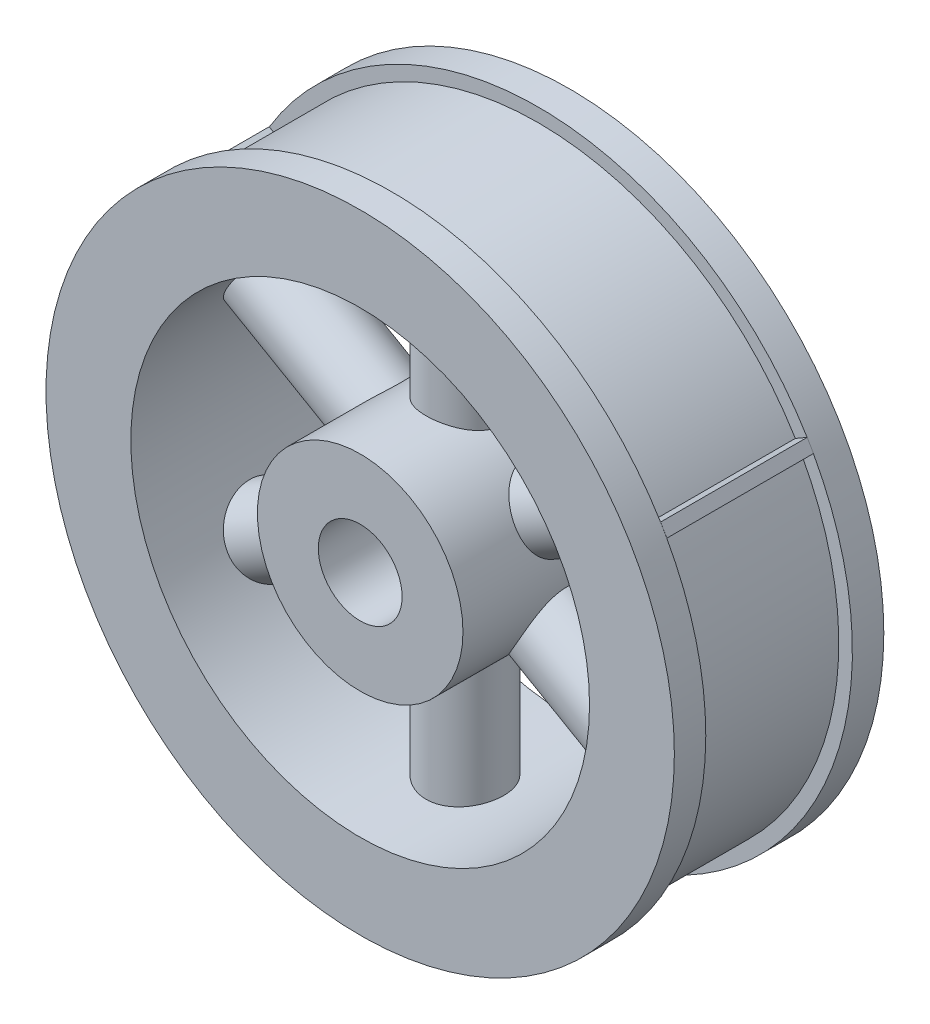
from build123d import *

# Parameters (mm, degrees)
SKETCH2_R           = 4.90735859
SKETCH2_R_2         = 2
BOSS_EXTRUDE1_DEPTH = 10
SKETCH3_R           = 14.35
SKETCH3_R_2         = 10.950119173
BOSS_EXTRUDE2_DEPTH = 10
SKETCH4_R           = 15
SKETCH4_R_2         = 14.35
BOSS_EXTRUDE3_DEPTH = 1.5
SKETCH5_R           = 15
SKETCH5_R_2         = 14.35
BOSS_EXTRUDE4_DEPTH = 1.5
BOSS_EXTRUDE5_DEPTH = 12.5
CIRPATTERN1_COUNT   = 6
SKETCH8_W           = 0.598057902
SKETCH8_H           = 0.656231918
BOSS_EXTRUDE6_DEPTH = 7
CIRPATTERN2_COUNT   = 3
SKETCH10_R          = 2
CUT_EXTRUDE1_DEPTH  = 10


with BuildPart() as part:
    # Sketch2 → Boss-Extrude1 (new body)
    with BuildSketch(Plane.XY):
        Circle(SKETCH2_R)
        Circle(SKETCH2_R_2, mode=Mode.SUBTRACT)
    extrude(amount=BOSS_EXTRUDE1_DEPTH)



with BuildPart() as body_2:
    # Sketch3 → Boss-Extrude2 (new body)
    with BuildSketch(Plane.XY):
        Circle(SKETCH3_R)
        Circle(SKETCH3_R_2, mode=Mode.SUBTRACT)
    extrude(amount=BOSS_EXTRUDE2_DEPTH)

    # Sketch4 → Boss-Extrude3 (add)
    with BuildSketch(Plane.XY):
        Circle(SKETCH4_R)
        Circle(SKETCH4_R_2, mode=Mode.SUBTRACT)
    extrude(amount=BOSS_EXTRUDE3_DEPTH)

    # Sketch5 → Boss-Extrude4 (add)
    with BuildSketch(Plane.XY.offset(10)):
        Circle(SKETCH5_R)
        Circle(SKETCH5_R_2, mode=Mode.SUBTRACT)
    extrude(amount=-BOSS_EXTRUDE4_DEPTH)


with BuildPart() as part_1:
    add(part.part)

    add(body_2.part)  # Boss-Extrude5 merges body 2
    # Sketch7 → Boss-Extrude5 (add)
    with BuildSketch(Plane(origin=(0, 0, 0), x_dir=(-1, 0, 0), z_dir=(0, 1, 0))):
        with BuildLine():
            ThreePointArc((0, 6.854596747), (-1.854596747, 5), (0, 3.145403253))
            Line((0, 3.145403253), (0, 6.854596747))
        make_face()
        with BuildLine():
            Line((0, 6.854596747), (0, 3.145403253))
            ThreePointArc((0, 3.145403253), (1.311397936, 3.688602064), (1.854596747, 5))
            ThreePointArc((1.854596747, 5), (1.311397936, 6.311397936), (0, 6.854596747))
        make_face()
    boss_extrude5 = extrude(amount=-BOSS_EXTRUDE5_DEPTH)

    # CirPattern1: Boss-Extrude5 ×6 about axis
    cirpattern1_axis = Axis((0, 0, 10), (0, 0, 1))
    for i in range(1, CIRPATTERN1_COUNT):
        add(boss_extrude5.rotate(cirpattern1_axis, i * 360 / CIRPATTERN1_COUNT))

    # Sketch8 → Boss-Extrude6 (add)
    with BuildSketch(Plane.XY.offset(1.5)):
        with Locations((0, -14.675)):
            Rectangle(SKETCH8_W, SKETCH8_H)
    boss_extrude6 = extrude(amount=BOSS_EXTRUDE6_DEPTH)

    # CirPattern2: Boss-Extrude6 ×3 about axis
    cirpattern2_axis = Axis((0, 0, 0), (0, 0, 1))
    for i in range(1, CIRPATTERN2_COUNT):
        add(boss_extrude6.rotate(cirpattern2_axis, i * 360 / CIRPATTERN2_COUNT))

    # Sketch10 → Cut-Extrude1 (cut)
    with BuildSketch(Plane(origin=(0, 0, 0), x_dir=(-1, 0, 0), z_dir=(0, 0, -1))):
        with Locations(Location((0, 0, 0), (0, 0, 180))):
            Circle(SKETCH10_R)
    extrude(amount=-CUT_EXTRUDE1_DEPTH, mode=Mode.SUBTRACT)


solid = part_1.part
